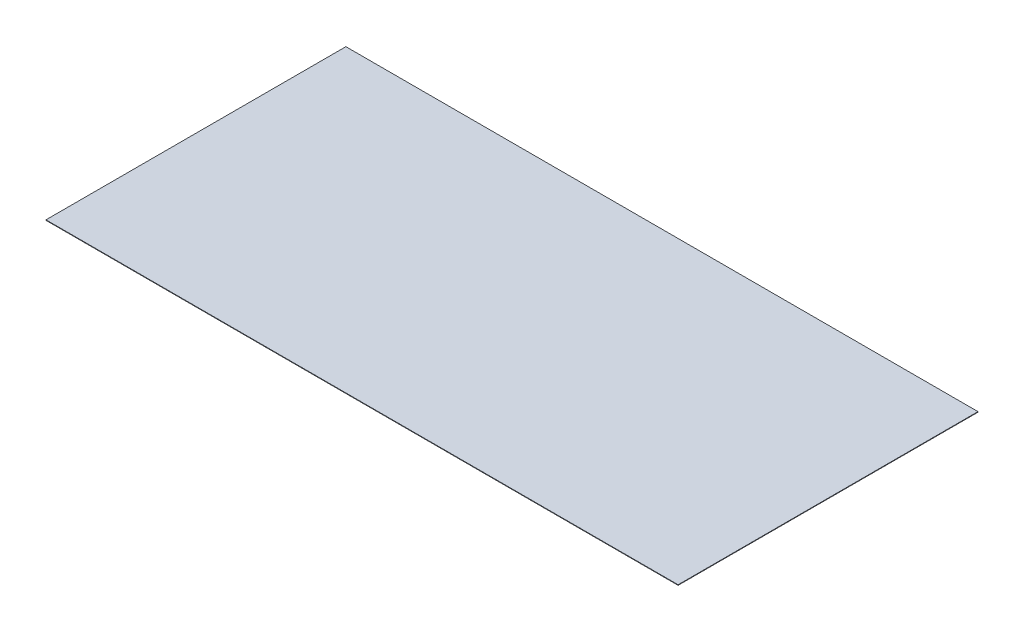
from build123d import *

# Parameters (mm, degrees)
SKETCH1_W           = 1250
SKETCH1_H           = 593
BOSS_EXTRUDE1_DEPTH = 1


with BuildPart() as part:
    # Sketch1 → Boss-Extrude1 (new body)
    with BuildSketch(Plane(origin=(0, 0, 0), x_dir=(1, 0, 0), z_dir=(0, 1, 0))):
        with Locations((-78.190544768, 151.114548674)):
            Rectangle(SKETCH1_W, SKETCH1_H)
    extrude(amount=BOSS_EXTRUDE1_DEPTH)


solid = part.part
